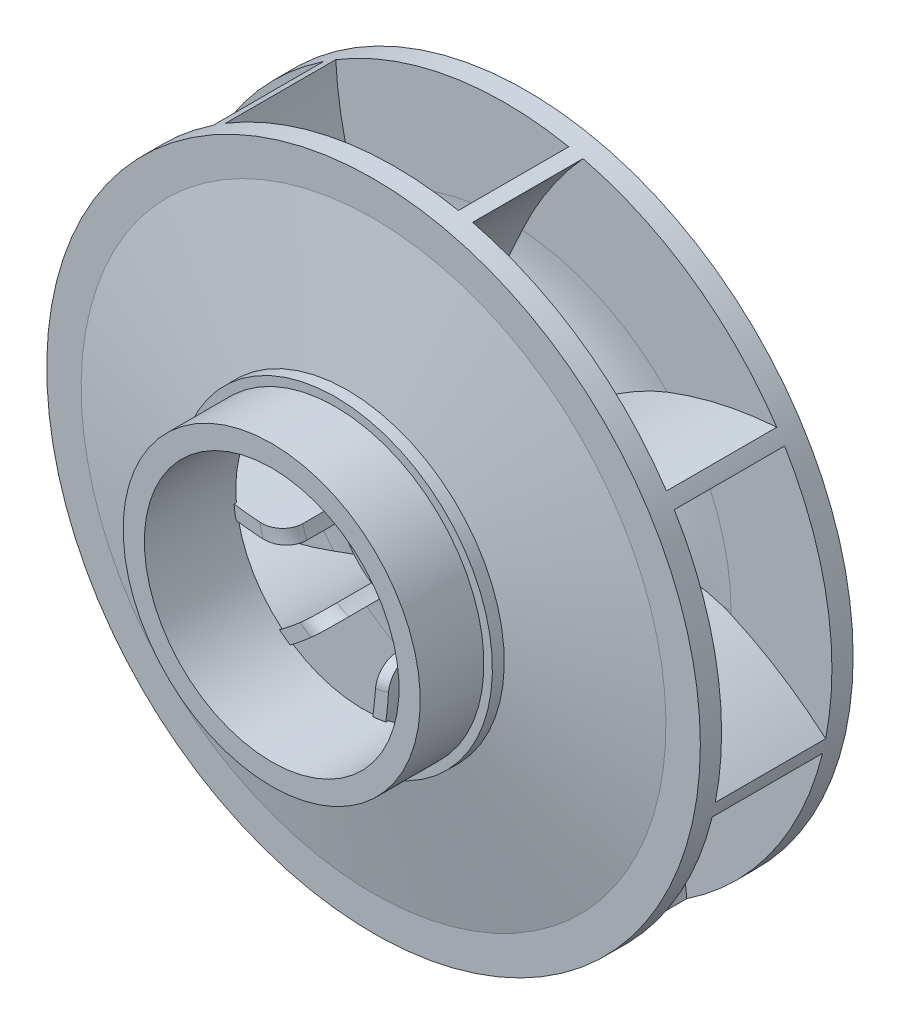
from build123d import *
from build123d.topology import SkipClean

# Parameters (mm, degrees)
BOSS_EXTRU_1_START                 = 34
BOSS_EXTRU_1_DEPTH                 = 34
CONG_1_R                           = 5
R_P_TITION_CIRCULAIRE1_COUNT       = 8
CONG_1_OF_R_P_TITION_CIRCULAIRE1_R = 5
ENL_V_MAT_EXTRU_1_REACH            = 120.604
ESQUISSE6_W                        = 6
ESQUISSE6_H                        = 5


with BuildPart() as part:
    # Esquisse1 → Révolution1 (revolve)
    with BuildSketch(Plane(origin=(0, 0, 0), x_dir=(0, 0, -1), z_dir=(1, 0, 0)), mode=Mode.PRIVATE) as r_volution1_sk:
        with BuildLine():
            Line((0, 17.5), (0, 9))
            Line((0, 9), (32, 9))
            Line((32, 9), (32, 22))
            Line((32, 22), (27, 22))
            Line((27, 22), (27, 36))
            Line((27, 36), (32, 36))
            Line((32, 36), (32, 37.5))
            Line((32, 37.5), (47, 37.5))
            Line((47, 37.5), (47, 42.5))
            Line((47, 42.5), (27, 42.5))
            Line((27, 42.5), (27, 77))
            Line((27, 77), (22, 77))
            Line((22, 77), (22, 53.221142199))
            ThreePointArc((22, 53.221142199), (16.058772732, 32.244965236), (0, 17.5))
        make_face()
    revolve(r_volution1_sk.sketch.rotate(Axis((0, 0, 0), (0, 0, -1)), 90), axis=Axis((0, 0, 0), (0, 0, -1)))

    # Esquisse2 → Boss.-Extru.1 (add)
    with BuildSketch(Plane.XY.offset(-22).offset(BOSS_EXTRU_1_START)):
        with BuildLine():
            ThreePointArc((10.580785698, 15.781222197), (36.007766894, 32.907176104), (65.85646563, 39.898946536))
            ThreePointArc((65.85646563, 39.898946536), (64.950250141, 41.357768395), (64.011725077, 42.796016786))
            ThreePointArc((64.011725077, 42.796016786), (33.624870946, 35.130206454), (7.851258512, 17.301957686))
            ThreePointArc((7.851258512, 17.301957686), (9.24733597, 16.597794355), (10.580785698, 15.781222197))
        make_face()
    boss_extru_1 = extrude(amount=-BOSS_EXTRU_1_DEPTH)

    # Congé1
    cong_1_edges = [part.edges().sort_by_distance(p)[0] for p in [
        (9.24733597, 16.597794355, 12),
    ]]
    fillet(cong_1_edges, radius=CONG_1_R)

    # Répétition circulaire1: Boss.-Extru.1 ×8 about axis
    r_p_tition_circulaire1_axis = Axis((0, 0, 0), (0, 0, 1))
    for i in range(1, R_P_TITION_CIRCULAIRE1_COUNT):
        add(boss_extru_1.rotate(r_p_tition_circulaire1_axis, i * 360 / R_P_TITION_CIRCULAIRE1_COUNT))

    # Congé1 of Répétition circulaire1
    cong_1_of_r_p_tition_circulaire1_edges = [part.edges().sort_by_distance(p)[0] for p in [
        (-5.197558969, 18.275266914, 12),
        (-16.597794355, 9.24733597, 12),
        (-18.275266914, -5.197558969, 12),
        (-9.24733597, -16.597794355, 12),
        (5.197558969, -18.275266914, 12),
        (16.597794355, -9.24733597, 12),
        (18.275266914, 5.197558969, 12),
    ]]
    fillet(cong_1_of_r_p_tition_circulaire1_edges, radius=CONG_1_OF_R_P_TITION_CIRCULAIRE1_R)

    # Esquisse3 → Révolution2 (revolve)
    with SkipClean():  # the faces are left unmerged after this step: merging them gives an invalid solid
        with BuildSketch(Plane(origin=(0, 0, 0), x_dir=(0, 0, -1), z_dir=(1, 0, 0)), mode=Mode.PRIVATE) as r_volution2_sk:
            Polygon((-33, 35), (-33, 30), (-11.467078689, 30), (-4, 68.414789658), (-4, 77), (-9, 77), (-9, 68.896234899), (-15.2, 37), (-18, 37), (-18, 35), align=None)
        revolve(r_volution2_sk.sketch.rotate(Axis((0, 0, 0), (0, 0, 1)), 270), axis=Axis((0, 0, 0), (0, 0, 1)))

    # Esquisse4 → Enlèvement de matière-Révolution1 (revolve, cut)
    with BuildSketch(Plane(origin=(0, 0, 0), x_dir=(0, 0, -1), z_dir=(1, 0, 0))):
        Polygon((-15.2, 37), (-15.2, 77.234133365), (-9, 77), (-9, 68.896234899), align=None)
    revolve(axis=Axis((0, 0, 0), (0, 0, 1)), mode=Mode.SUBTRACT)

    # Esquisse6 → Enlèv. mat.-Extru.1 (cut, up to next)
    with BuildSketch(Plane.XY, mode=Mode.PRIVATE) as enl_v_mat_extru_1_sk1:
        with Locations((0, 9.3)):
            Rectangle(ESQUISSE6_W, ESQUISSE6_H)
    enl_v_mat_extru_1_tool1 = extrude(enl_v_mat_extru_1_sk1.sketch, amount=-ENL_V_MAT_EXTRU_1_REACH, mode=Mode.PRIVATE) & part.part
    add(enl_v_mat_extru_1_tool1.solids().sort_by_distance((0, 9.3, 0))[0], mode=Mode.SUBTRACT)


solid = part.part
